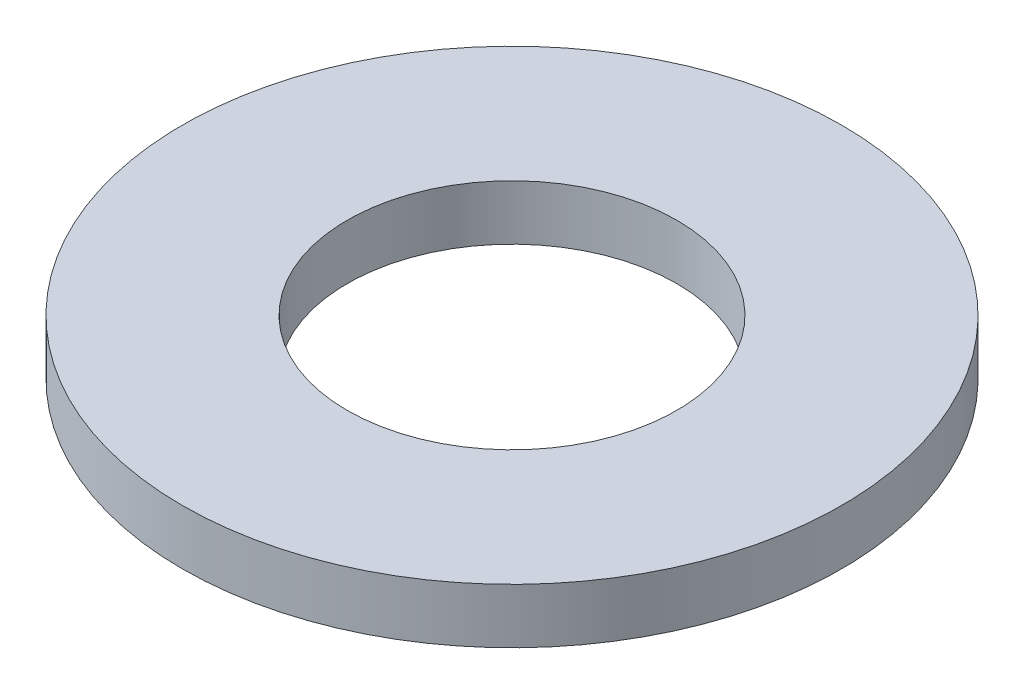
from build123d import *

# Parameters (mm, degrees)
SKETCH_1_R      = 3
SKETCH_1_R_2    = 1.5
EXTRUDE_1_DEPTH = 0.5


with BuildPart() as part:
    # 草图1 → 凸台-拉伸1 (new body)
    with BuildSketch(Plane(origin=(0, 0, 0), x_dir=(1, 0, 0), z_dir=(0, 1, 0))):
        with Locations(Location((0, 0, 0), (0, 0, 270))):
            Circle(SKETCH_1_R)
        with Locations(Location((0, 0, 0), (0, 0, 270))):
            Circle(SKETCH_1_R_2, mode=Mode.SUBTRACT)
    extrude(amount=EXTRUDE_1_DEPTH)


solid = part.part
